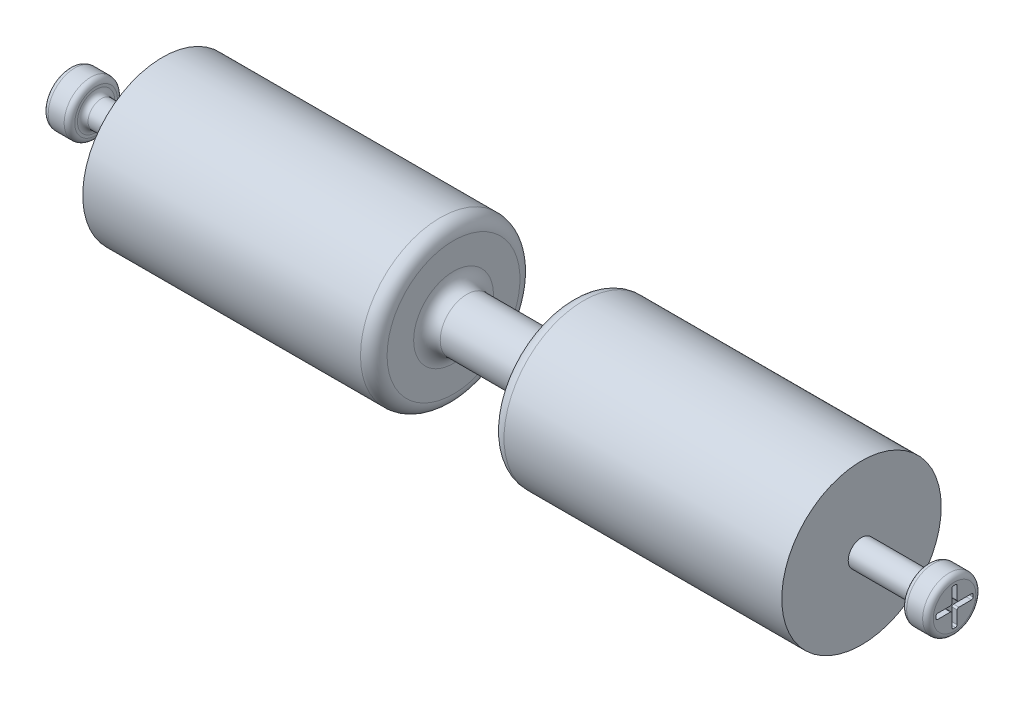
from build123d import *

# Parameters (mm, degrees)
BOSS_EXTRUDE1_DEPTH      = 167.005
BOSS_EXTRUDE1_DEPTH_BACK = 167.005
SKETCH1_R                = 38.1
SKETCH2_R                = 6.35
BOSS_EXTRUDE2_DEPTH      = 31.75
SKETCH3_R                = 12.7
BOSS_EXTRUDE3_DEPTH      = 12.7
SKETCH4_W                = 55.88
SKETCH4_H                = 50.8
FILLET1_R                = 6.35
FILLET2_R                = 6.35
FILLET3_R                = 6.35
FILLET4_R                = 6.35
FILLET6_R                = 2.54
CUT_EXTRUDE1_DEPTH       = 2.54
FILLET6_OF_MIRROR1_R     = 2.54


with BuildPart() as part:
    # Sketch1 → Boss-Extrude1 (new, two sides: drawn at the far end of the back side and taken through both)
    with BuildSketch(Plane(origin=(0, 0, 0), x_dir=(0, 0, -1), z_dir=(1, 0, 0)).offset(-BOSS_EXTRUDE1_DEPTH_BACK)):
        Circle(SKETCH1_R)
    extrude(amount=BOSS_EXTRUDE1_DEPTH + BOSS_EXTRUDE1_DEPTH_BACK)

    # Sketch2 → Boss-Extrude2 (add)
    with BuildSketch(Plane.ZY.offset(167.005)):
        Circle(SKETCH2_R)
    boss_extrude2 = extrude(amount=BOSS_EXTRUDE2_DEPTH)

    # Sketch3 → Boss-Extrude3 (add)
    with BuildSketch(Plane.ZY.offset(198.755)):
        Circle(SKETCH3_R)
    boss_extrude3 = extrude(amount=BOSS_EXTRUDE3_DEPTH)

    # Sketch4 → Cut-Revolve1 (revolve, cut)
    with BuildSketch(Plane(origin=(0, 0, 0), x_dir=(1, 0, 0), z_dir=(0, 1, 0))):
        with Locations((0, 38.1)):
            Rectangle(SKETCH4_W, SKETCH4_H)
    revolve(axis=Axis((211.564607527, 0, 0), (-1, 0, 0)), mode=Mode.SUBTRACT)

    # Fillet1
    fillet1_edges = [part.edges().sort_by_distance(p)[0] for p in [
        (-27.94, 0, 38.1),
    ]]
    fillet(fillet1_edges, radius=FILLET1_R)

    # Fillet2
    fillet2_edges = [part.edges().sort_by_distance(p)[0] for p in [
        (-27.94, 0, 12.7),
    ]]
    fillet(fillet2_edges, radius=FILLET2_R)

    # Fillet3
    fillet3_edges = [part.edges().sort_by_distance(p)[0] for p in [
        (27.94, 0, 12.7),
    ]]
    fillet(fillet3_edges, radius=FILLET3_R)

    # Fillet4
    fillet4_edges = [part.edges().sort_by_distance(p)[0] for p in [
        (27.94, 0, 38.1),
    ]]
    fillet(fillet4_edges, radius=FILLET4_R)

    # Fillet6
    fillet6_edges = [part.edges().sort_by_distance(p)[0] for p in [
        (-198.755, 0, -12.7),
        (-211.455, 0, -12.7),
        (-198.755, 0, -6.35),
    ]]
    fillet(fillet6_edges, radius=FILLET6_R)

    # Sketch5 → Cut-Extrude1 (cut)
    with BuildSketch(Plane.ZY.offset(211.455)):
        with BuildLine():
            Line((1.27, -2.032), (1.27, -8.128))
            ThreePointArc((1.27, -8.128), (1.046815367, -8.666815367), (0.508, -8.89))
            Line((0.508, -8.89), (-0.508, -8.89))
            ThreePointArc((-0.508, -8.89), (-1.046815367, -8.666815367), (-1.27, -8.128))
            Line((-1.27, -8.128), (-1.27, -2.032))
            ThreePointArc((-1.27, -2.032), (-1.493184633, -1.493184633), (-2.032, -1.27))
            Line((-2.032, -1.27), (-8.128, -1.27))
            ThreePointArc((-8.128, -1.27), (-8.666815367, -1.046815367), (-8.89, -0.508))
            Line((-8.89, -0.508), (-8.89, 0.508))
            ThreePointArc((-8.89, 0.508), (-8.666815367, 1.046815367), (-8.128, 1.27))
            Line((-8.128, 1.27), (-2.032, 1.27))
            ThreePointArc((-2.032, 1.27), (-1.493184633, 1.493184633), (-1.27, 2.032))
            Line((-1.27, 2.032), (-1.27, 8.128))
            ThreePointArc((-1.27, 8.128), (-1.046815367, 8.666815367), (-0.508, 8.89))
            Line((-0.508, 8.89), (0.508, 8.89))
            ThreePointArc((0.508, 8.89), (1.046815367, 8.666815367), (1.27, 8.128))
            Line((1.27, 8.128), (1.27, 2.032))
            ThreePointArc((1.27, 2.032), (1.493184633, 1.493184633), (2.032, 1.27))
            Line((2.032, 1.27), (8.128, 1.27))
            ThreePointArc((8.128, 1.27), (8.666815367, 1.046815367), (8.89, 0.508))
            Line((8.89, 0.508), (8.89, -0.508))
            ThreePointArc((8.89, -0.508), (8.666815367, -1.046815367), (8.128, -1.27))
            Line((8.128, -1.27), (2.032, -1.27))
            ThreePointArc((2.032, -1.27), (1.493184633, -1.493184633), (1.27, -2.032))
        make_face()
    cut_extrude1 = extrude(amount=-CUT_EXTRUDE1_DEPTH, mode=Mode.SUBTRACT)

    # Mirror1: Boss-Extrude2, Boss-Extrude3, Cut-Extrude1 across plane
    add(boss_extrude2.mirror(Plane(origin=(0, 0, 0), x_dir=(0, 0, 1), z_dir=(1, 0, 0))))
    add(boss_extrude3.mirror(Plane(origin=(0, 0, 0), x_dir=(0, 0, 1), z_dir=(1, 0, 0))))
    add(cut_extrude1.mirror(Plane(origin=(0, 0, 0), x_dir=(0, 0, 1), z_dir=(1, 0, 0))), mode=Mode.SUBTRACT)

    # Fillet6 of Mirror1
    fillet6_of_mirror1_edges = [part.edges().sort_by_distance(p)[0] for p in [
        (198.755, 0, -12.7),
        (211.455, 0, -12.7),
        (198.755, 0, -6.35),
    ]]
    fillet(fillet6_of_mirror1_edges, radius=FILLET6_OF_MIRROR1_R)


solid = part.part
